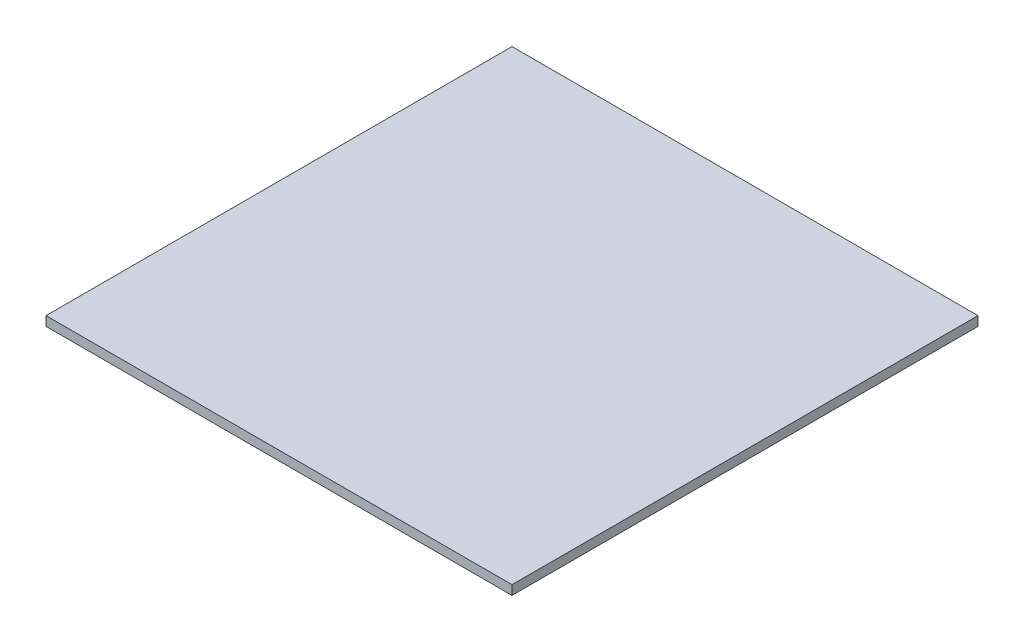
from build123d import *

# Parameters (mm, degrees)
SKETCH1_W           = 100
SKETCH1_H           = 100
BOSS_EXTRUDE1_DEPTH = 2


with BuildPart() as part:
    # Sketch1 → Boss-Extrude1 (new body)
    with BuildSketch(Plane(origin=(0, 0, 0), x_dir=(1, 0, 0), z_dir=(0, 1, 0))):
        Rectangle(SKETCH1_W, SKETCH1_H)
    extrude(amount=BOSS_EXTRUDE1_DEPTH)


solid = part.part
